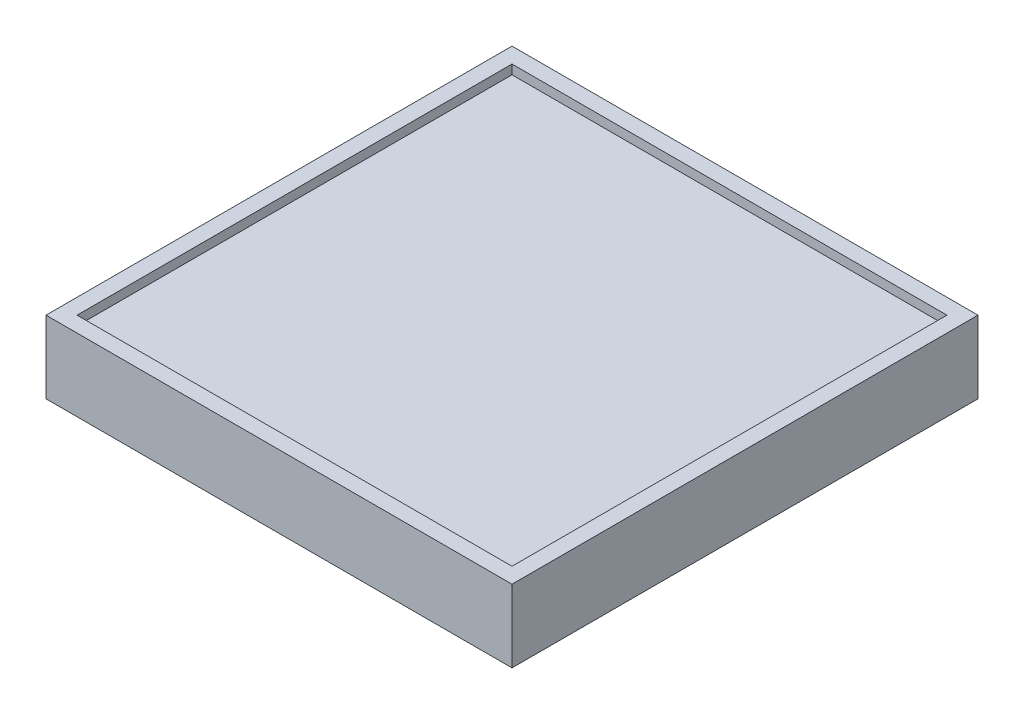
from build123d import *

# Parameters (mm, degrees)
SKETCH1_W           = 45
SKETCH1_H           = 45
BOSS_EXTRUDE1_DEPTH = 7
SKETCH2_W           = 42
SKETCH2_H           = 42
CUT_EXTRUDE1_DEPTH  = 0.9
SKETCH4_W           = 43.5
SKETCH4_H           = 43.5
CUT_EXTRUDE2_DEPTH  = 0.7


with BuildPart() as part:
    # Sketch1 → Boss-Extrude1 (new body)
    with BuildSketch(Plane(origin=(0, 0, 0), x_dir=(1, 0, 0), z_dir=(0, 1, 0))):
        Rectangle(SKETCH1_W, SKETCH1_H)
    extrude(amount=BOSS_EXTRUDE1_DEPTH)

    # Sketch2 → Cut-Extrude1 (cut)
    with BuildSketch(Plane(origin=(0, 7, 0), x_dir=(1, 0, 0), z_dir=(0, 1, 0))):
        Rectangle(SKETCH2_W, SKETCH2_H)
    extrude(amount=-CUT_EXTRUDE1_DEPTH, mode=Mode.SUBTRACT)

    # Sketch4 → Cut-Extrude2 (cut)
    with BuildSketch(Plane(origin=(0, 6.1, 0), x_dir=(1, 0, 0), z_dir=(0, 1, 0))):
        Rectangle(SKETCH4_W, SKETCH4_H)
    extrude(amount=-CUT_EXTRUDE2_DEPTH, mode=Mode.SUBTRACT)


solid = part.part
